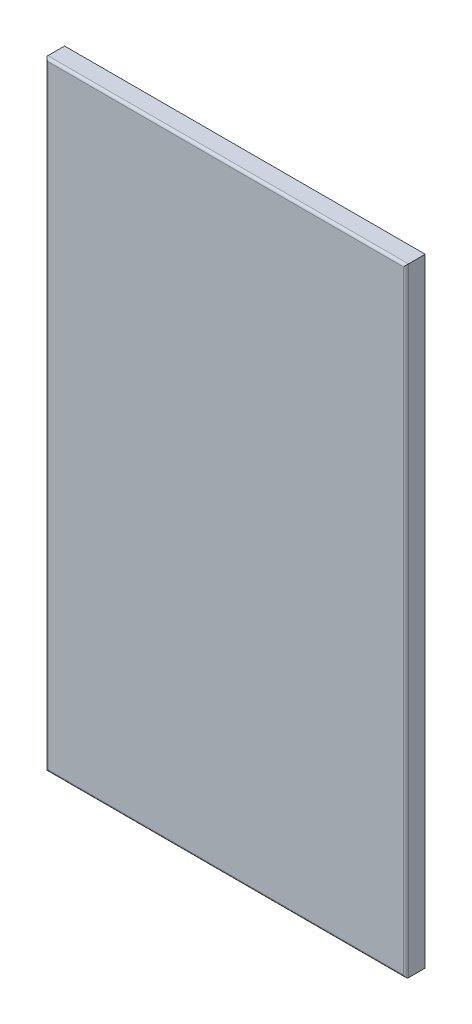
from build123d import *

# Parameters (mm, degrees)
SKETCH1_W           = 355.6
SKETCH1_H           = 609.6
BOSS_EXTRUDE1_DEPTH = 2.54
SKETCH2_W           = 355.6
SKETCH2_H           = 609.6
SKETCH2_W_2         = 350.52
SKETCH2_H_2         = 604.52
BOSS_EXTRUDE2_DEPTH = 19.05
FILLET1_R           = 2.54


with BuildPart() as part:
    # Sketch1 → Boss-Extrude1 (new body)
    with BuildSketch(Plane.XY):
        Rectangle(SKETCH1_W, SKETCH1_H)
    extrude(amount=BOSS_EXTRUDE1_DEPTH)

    # Sketch2 → Boss-Extrude2 (add)
    with BuildSketch(Plane.XY.offset(2.54)):
        Rectangle(SKETCH2_W, SKETCH2_H)
        Rectangle(SKETCH2_W_2, SKETCH2_H_2, mode=Mode.SUBTRACT)
    extrude(amount=-BOSS_EXTRUDE2_DEPTH)

    # Fillet1
    fillet1_edges = [part.edges().sort_by_distance(p)[0] for p in [
        (177.8, 0, 2.54),
        (0, 304.8, 2.54),
        (-177.8, 0, 2.54),
        (0, -304.8, 2.54),
    ]]
    fillet(fillet1_edges, radius=FILLET1_R)


solid = part.part
